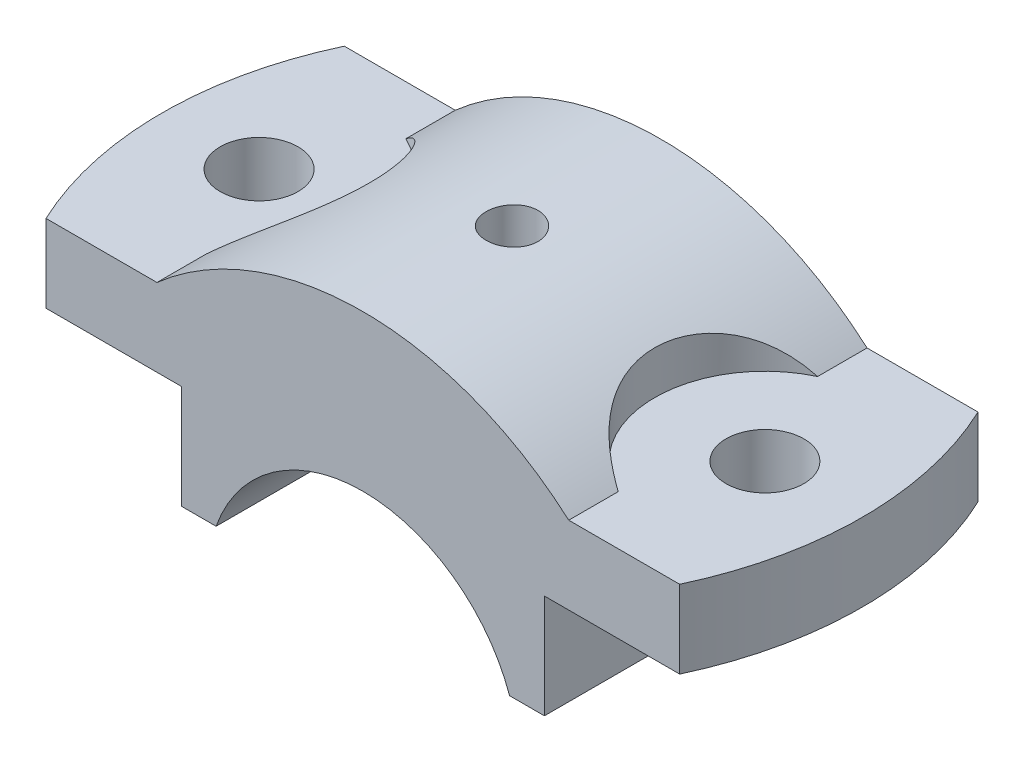
from build123d import *

# Parameters (mm, degrees)
BOSS_EXTRUDE1_DEPTH = 23
SKETCH3_R           = 6
CUT_EXTRUDE1_DEPTH  = 66.030761952
CUT_EXTRUDE3_DEPTH  = 66.030761952


with BuildPart() as part:
    # Sketch1 → Boss-Extrude1 (new, symmetric)
    with BuildSketch(Plane.XY):
        with BuildLine():
            Line((-28, 24), (-54, 24))
            Line((-54, 24), (-54, 36))
            Line((-54, 36), (-31.749015733, 36))
            ThreePointArc((-31.749015733, 36), (0, 48), (31.749015733, 36))
            Line((31.749015733, 36), (54, 36))
            Line((54, 36), (54, 24))
            Line((54, 24), (28, 24))
            Line((28, 24), (28, 8))
            Line((28, 8), (22.627416998, 8))
            ThreePointArc((22.627416998, 8), (0, 24), (-22.627416998, 8))
            Line((-22.627416998, 8), (-28, 8))
            Line((-28, 8), (-28, 24))
        make_face()
    extrude(amount=BOSS_EXTRUDE1_DEPTH, both=True)

    # Sketch3 → Cut-Extrude1 (cut, through all)
    with BuildSketch(Plane(origin=(0, 36, 0), x_dir=(1, 0, 0), z_dir=(0, 1, 0))):
        with BuildLine():
            Line((-54, 23), (-54, -2.63e-07))
            ThreePointArc((-54, -2.63e-07), (-52.698550464, 11.784005217), (-48.856934001, 23))
            Line((-48.856934001, 23), (-54, 23))
        make_face()
        with BuildLine():
            Line((-54, -23), (-48.856934001, -23))
            ThreePointArc((-48.856934001, -23), (-52.698550407, -11.784005473), (-54, -2.63e-07))
            Line((-54, -2.63e-07), (-54, -23))
        make_face()
        with Locations((-39, 0)):
            Circle(SKETCH3_R)
    cut_extrude1 = extrude(amount=-CUT_EXTRUDE1_DEPTH, mode=Mode.SUBTRACT)

    # Sketch3<3> → Cut-Extrude3 (cut, through all)
    with BuildSketch(Plane(origin=(0, 36, 0), x_dir=(1, 0, 0), z_dir=(0, 1, 0))):
        with BuildLine():
            Line((-31.749015733, 15.376060196), (-31.749015733, -15.376060196))
            ThreePointArc((-31.749015733, -15.376060196), (-22, 0), (-31.749015733, 15.376060196))
        make_face()
    cut_extrude3 = extrude(amount=CUT_EXTRUDE3_DEPTH, mode=Mode.SUBTRACT)

    # Mirror1: Cut-Extrude1, Cut-Extrude3 across plane
    add(cut_extrude1.mirror(Plane(origin=(0, 0, 0), x_dir=(0, 0, 1), z_dir=(1, 0, 0))), mode=Mode.SUBTRACT)
    add(cut_extrude3.mirror(Plane(origin=(0, 0, 0), x_dir=(0, 0, 1), z_dir=(1, 0, 0))), mode=Mode.SUBTRACT)

    # Sketch9 → Cut-Revolve1 (revolve, cut)
    with BuildSketch(Plane.XY):
        Polygon((0, 48), (4, 48), (4, 32), (3, 32), (3, 23.8117618), (0, 23.8117618), align=None)
    revolve(axis=Axis((0, 23.8117618, 0), (0, 1, 0)), mode=Mode.SUBTRACT)


solid = part.part
